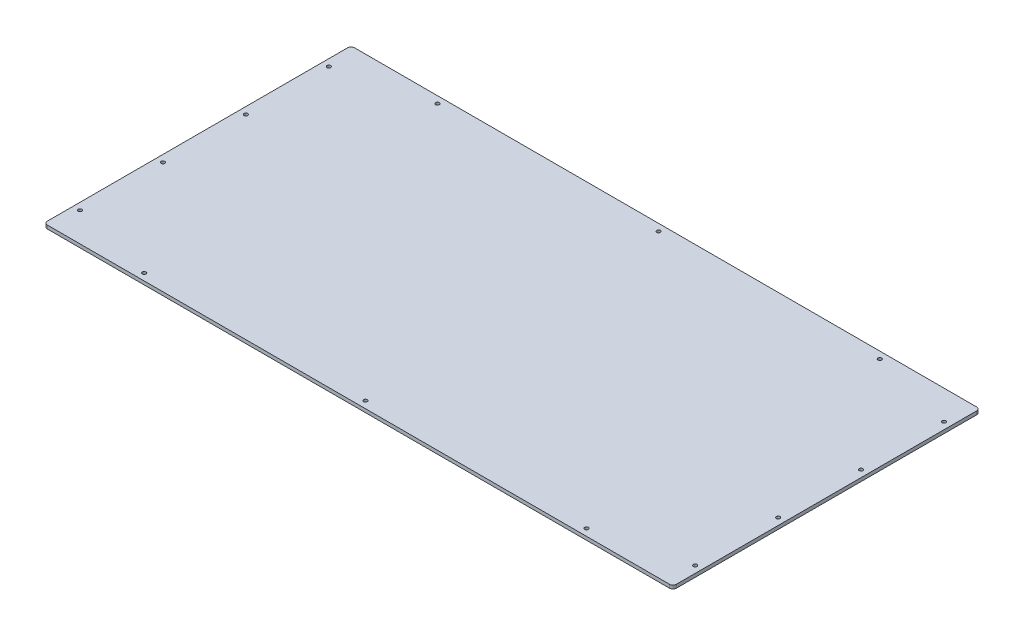
from build123d import *

# Parameters (mm, degrees)
SKETCH1_W                        = 1155.7
SKETCH1_H                        = 564.26608
BOSS_EXTRUDE1_DEPTH              = 6.35
FILLET1_R                        = 6.35
F_17_64_0_26563_DIAMETER_HOLE1_D = 6.747002


with BuildPart() as part:
    # Sketch1 → Boss-Extrude1 (new body)
    with BuildSketch(Plane(origin=(0, 0, 0), x_dir=(1, 0, 0), z_dir=(0, 1, 0))):
        Rectangle(SKETCH1_W, SKETCH1_H)
    extrude(amount=BOSS_EXTRUDE1_DEPTH)

    # Fillet1
    fillet1_edges = [part.edges().sort_by_distance(p)[0] for p in [
        (577.85, 3.175, 282.13304),
        (-577.85, 3.175, 282.13304),
        (-577.85, 3.175, -282.13304),
        (577.85, 3.175, -282.13304),
    ]]
    fillet(fillet1_edges, radius=FILLET1_R)

    # 17/64 (0.26563) Diameter Hole1 (through all)
    with Locations(Plane(origin=(0, 6.35, 0), x_dir=(1, 0, 0), z_dir=(0, 1, 0))):
        with Locations((-565.15, 228.6), (-565.15, 76.2), (-565.15, -76.2), (-565.15, -228.6), (565.15, 228.6), (565.15, 76.2), (565.15, -76.2), (565.15, -228.6), (-406.4, 269.43304), (0, 269.43304), (406.4, 269.43304), (406.4, -269.43304), (0, -269.43304), (-406.4, -269.43304)):
            Hole(F_17_64_0_26563_DIAMETER_HOLE1_D / 2)


solid = part.part
